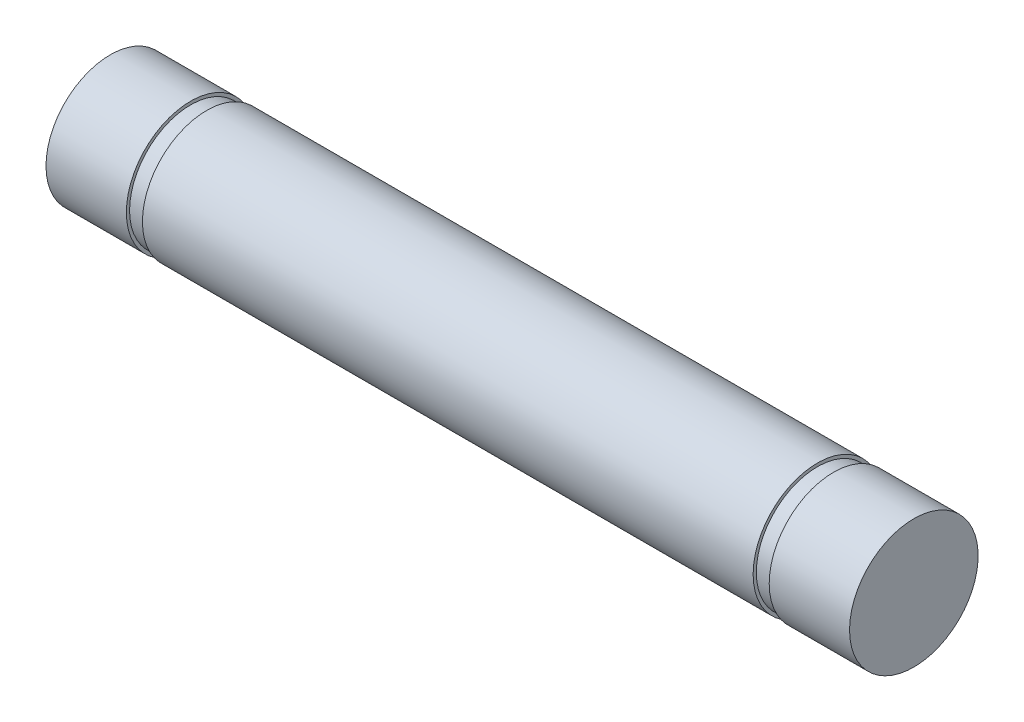
from build123d import *


with BuildPart() as part:
    # Çizim1 → Döndür1 (revolve)
    with BuildSketch(Plane.XY, mode=Mode.PRIVATE) as d_nd_r1_sk:
        Polygon((0, 0), (25, 0), (25, 2), (22.5, 2), (22.5, 1.9), (22, 1.9), (22, 2), (3, 2), (3, 1.9), (2.5, 1.9), (2.5, 2), (0, 2), align=None)
    revolve(d_nd_r1_sk.sketch.rotate(Axis((0, 0, 0), (1, 0, 0)), 90), axis=Axis((0, 0, 0), (1, 0, 0)))


solid = part.part
